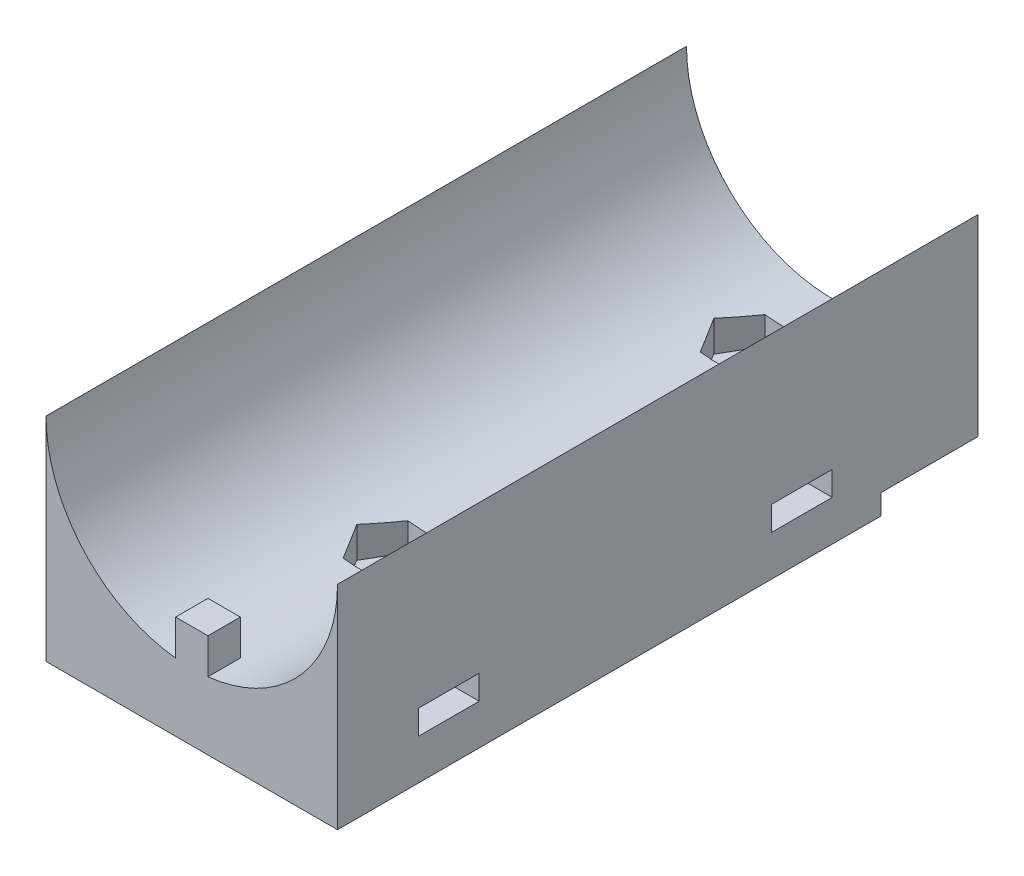
from build123d import *

# Parameters (mm, degrees)
BOSS_EXTRU_1_DEPTH       = 79.1
ESQUISSE7_W              = 7.5
ESQUISSE7_H              = 3
BOSS_EXTRU_3_DEPTH       = 36
ESQUISSE7_2_W            = 7.5
ESQUISSE7_2_H            = 3
ENL_V_MAT_EXTRU_5_DEPTH  = 36
ESQUISSE9_W              = 4
ESQUISSE9_H              = 4
BOSS_EXTRU_6_DEPTH       = 12.75
ESQUISSE11_R             = 2.5
ENL_V_MAT_EXTRU_6_DEPTH  = 10
ENL_V_START              = -5
ENL_V_MAT_EXTRU_12_DEPTH = 10
ESQUISSE13_W             = 11.5
ESQUISSE13_H             = 12
ENL_V_MAT_EXTRU_13_DEPTH = 2.5


with BuildPart() as part:
    # Esquisse1 → Boss.-Extru.1 (new body)
    with BuildSketch(Plane.XY.offset(1608.553140947)):
        with BuildLine():
            Line((0, 0), (36, 0))
            Line((36, 0), (36, 26.25))
            ThreePointArc((36, 26.25), (18, 8.25), (0, 26.25))
            Line((0, 26.25), (0, 0))
        make_face()
    extrude(amount=BOSS_EXTRU_1_DEPTH)

    # Esquisse7 → Boss.-Extru.3 (add)
    with BuildSketch(Plane(origin=(36, 0, 0), x_dir=(0, 0, -1), z_dir=(1, 0, 0))):
        with Locations((-1673.903140947, 6.5)):
            Rectangle(ESQUISSE7_W, ESQUISSE7_H)
        with Locations((-1630.303140947, 6.5)):
            Rectangle(ESQUISSE7_W, ESQUISSE7_H)
    extrude(amount=-BOSS_EXTRU_3_DEPTH)

    # Esquisse7<2> → Enlèv. mat.-Extru.5 (cut)
    with BuildSketch(Plane(origin=(36, 0, 0), x_dir=(0, 0, -1), z_dir=(1, 0, 0))):
        with Locations((-1673.903140947, 6.5)):
            Rectangle(ESQUISSE7_2_W, ESQUISSE7_2_H)
        with Locations((-1630.303140947, 6.5)):
            Rectangle(ESQUISSE7_2_W, ESQUISSE7_2_H)
    extrude(amount=-ENL_V_MAT_EXTRU_5_DEPTH, mode=Mode.SUBTRACT)

    # Esquisse9 → Boss.-Extru.6 (add)
    with BuildSketch(Plane.XZ):
        with Locations((18, 1685.653140947)):
            Rectangle(ESQUISSE9_W, ESQUISSE9_H)
    extrude(amount=-BOSS_EXTRU_6_DEPTH)

    # Esquisse11 → Enlèv. mat.-Extru.6 (cut)
    with BuildSketch(Plane.XZ):
        with Locations(Location((18, 1662.653140947, 0), (0, 0, 270))):
            Circle(ESQUISSE11_R)
        with Locations(Location((18, 1618.553140947, 0), (0, 0, 270))):
            Circle(ESQUISSE11_R)
    extrude(amount=-ENL_V_MAT_EXTRU_6_DEPTH, mode=Mode.SUBTRACT)

    # Esquisse12 → Enlèv. mat.-Extru.12 (cut)
    with BuildSketch(Plane.XZ.offset(ENL_V_START)):
        Polygon((20.309401077, 1622.553140947), (15.690598923, 1622.553140947), (13.381197846, 1618.553140947), (15.690598923, 1614.553140947), (20.309401077, 1614.553140947), (22.618802154, 1618.553140947), align=None)
        Polygon((20.309401077, 1666.653140947), (15.690598923, 1666.653140947), (13.381197846, 1662.653140947), (15.690598923, 1658.653140947), (20.309401077, 1658.653140947), (22.618802154, 1662.653140947), align=None)
    extrude(amount=-ENL_V_MAT_EXTRU_12_DEPTH, mode=Mode.SUBTRACT)

    # Esquisse13 → Enlèv. mat.-Extru.13 (cut)
    with BuildSketch(Plane.XZ):
        with Locations((30.25, 1614.553140947)):
            Rectangle(ESQUISSE13_W, ESQUISSE13_H)
        with Locations((5.75, 1614.553140947)):
            Rectangle(ESQUISSE13_W, ESQUISSE13_H)
    extrude(amount=-ENL_V_MAT_EXTRU_13_DEPTH, mode=Mode.SUBTRACT)


solid = part.part
